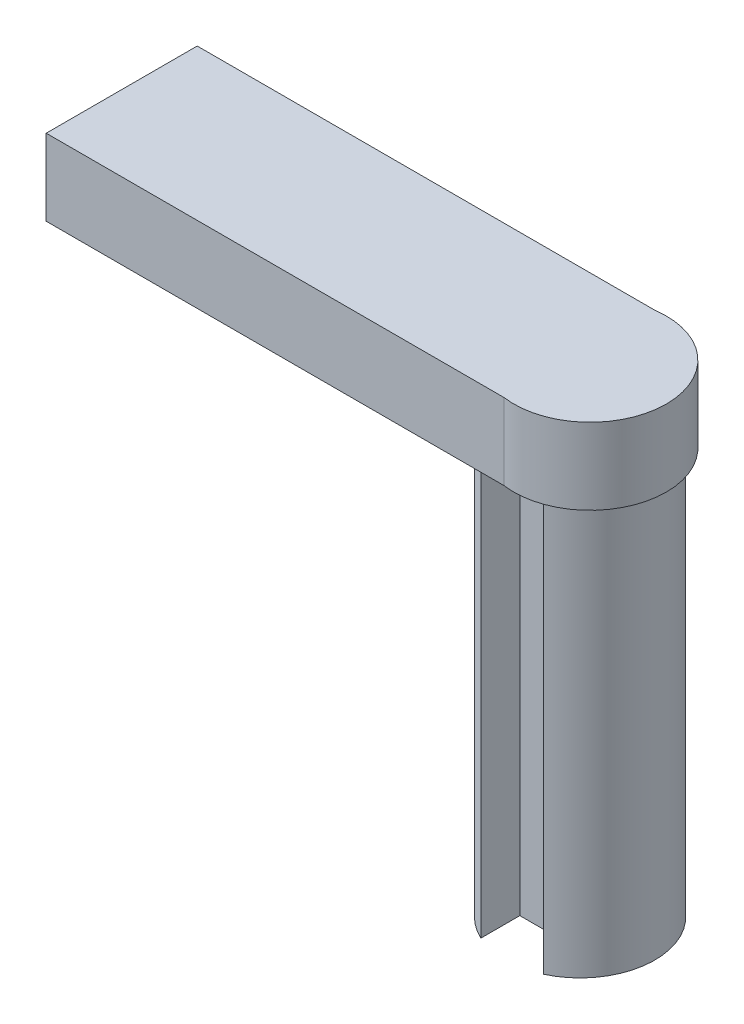
from build123d import *

# Parameters (mm, degrees)
SKETCH1_R           = 4.9
BOSS_EXTRUDE1_DEPTH = 27
CUT_EXTRUDE1_START  = -28
CUT_EXTRUDE1_DEPTH  = 28
BOSS_EXTRUDE2_DEPTH = 5


with BuildPart() as part:
    # Sketch1 → Boss-Extrude1 (new body)
    with BuildSketch(Plane(origin=(0, 0, 0), x_dir=(1, 0, 0), z_dir=(0, 1, 0))):
        with Locations(Location((0, 0, 0), (0, 0, 270))):
            Circle(SKETCH1_R)
    extrude(amount=BOSS_EXTRUDE1_DEPTH)

    # Sketch3 → Cut-Extrude1 (cut)
    with BuildSketch(Plane(origin=(0, 27, 0), x_dir=(1, 0, 0), z_dir=(0, 1, 0)).offset(CUT_EXTRUDE1_START)):
        with BuildLine():
            Line((-2.05, -4.450561762), (-2.05, -1.900561762))
            Line((-2.05, -1.900561762), (2.05, -1.900561762))
            Line((2.05, -1.900561762), (2.05, -4.450561762))
            ThreePointArc((2.05, -4.450561762), (0, -4.9), (-2.05, -4.450561762))
        make_face()
    extrude(amount=CUT_EXTRUDE1_DEPTH, mode=Mode.SUBTRACT)

    # Sketch2 → Boss-Extrude2 (add)
    with BuildSketch(Plane(origin=(0, 27, 0), x_dir=(1, 0, 0), z_dir=(0, 1, 0))):
        with BuildLine():
            Line((0, 4.9), (-30, 4.9))
            Line((-30, 4.9), (-30, -5))
            Line((-30, -5), (0, -5))
            ThreePointArc((0, -5), (5.705336799, -0.05), (0, 4.9))
        make_face()
    extrude(amount=BOSS_EXTRUDE2_DEPTH)


solid = part.part
